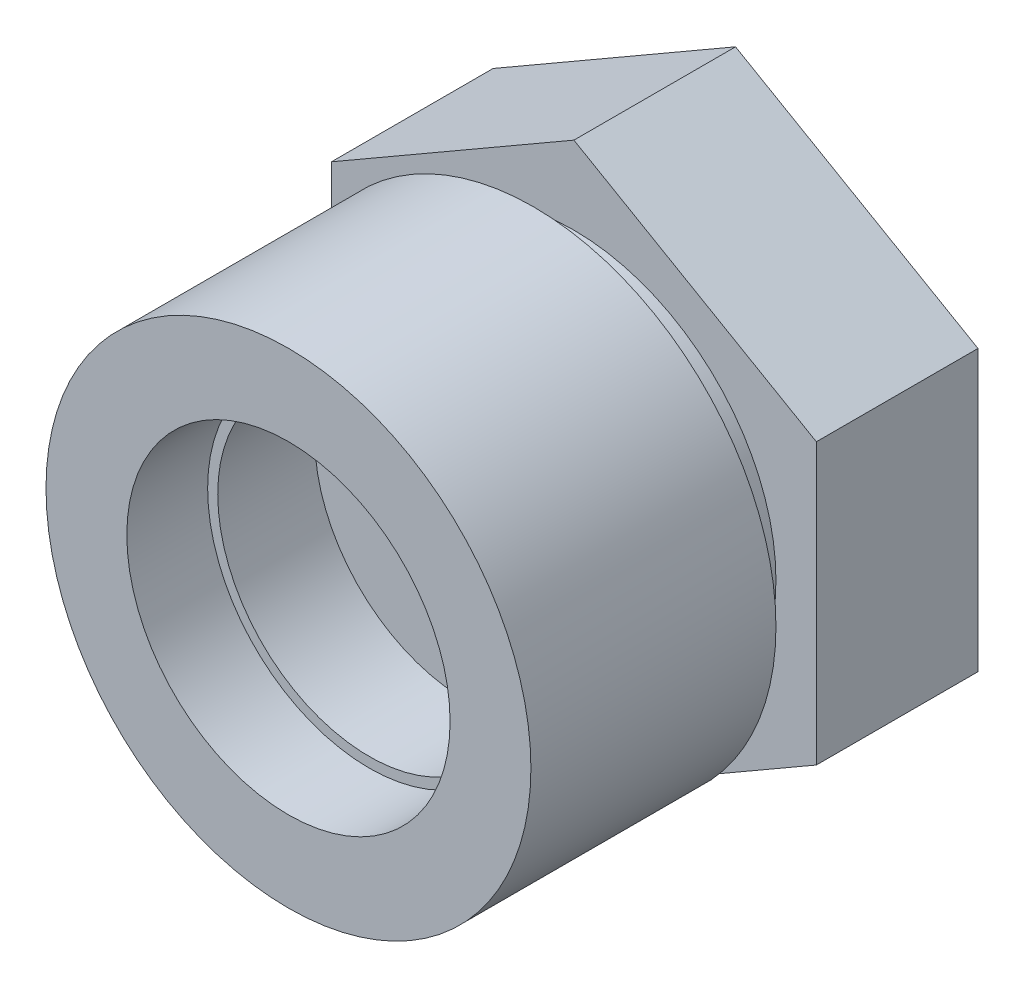
from build123d import *

# Parameters (mm, degrees)
BOSS_EXTRUDE1_DEPTH = 6.35
SKETCH2_R           = 7.9375
BOSS_EXTRUDE3_DEPTH = 1.5875
SKETCH7_R           = 9.525
BOSS_EXTRUDE4_DEPTH = 9.6266
SKETCH10_W          = 2.5527
SKETCH10_H          = 17.5641
SKETCH12_R          = 6.35
CUT_EXTRUDE5_DEPTH  = 3.175
SKETCH13_R          = 5.953125
CUT_EXTRUDE6_DEPTH  = 3.81


with BuildPart() as part:
    # Sketch1 → Boss-Extrude1 (new body)
    with BuildSketch(Plane.XY):
        Polygon((0, -10.998522628), (9.525, -5.499261314), (9.525, 5.499261314), (0, 10.998522628), (-9.525, 5.499261314), (-9.525, -5.499261314), align=None)
    extrude(amount=-BOSS_EXTRUDE1_DEPTH)


with BuildPart() as body_2:
    # Sketch2 → Boss-Extrude3 (new body)
    with BuildSketch(Plane.XY):
        Circle(SKETCH2_R)
    extrude(amount=BOSS_EXTRUDE3_DEPTH)


with BuildPart() as body_3:
    # Sketch7 → Boss-Extrude4 (new body)
    with BuildSketch(Plane.XY.offset(1.5875)):
        Circle(SKETCH7_R)
    extrude(amount=BOSS_EXTRUDE4_DEPTH)


with BuildPart() as f_1_4_20_tapped_hole1_tool:
    # Sketch10 → 1/4-20 Tapped Hole1 (revolve)
    with BuildSketch(Plane(origin=(0, 0, -6.35), x_dir=(0, 1, 0), z_dir=(1, 0, 0))):
        with Locations((1.27635, 8.78205)):
            Rectangle(SKETCH10_W, SKETCH10_H)
    revolve(axis=Axis((0, 0, -12.7), (0, 0, 1)))


with BuildPart() as part_1:
    add(part.part)

    # 1/4-20 Tapped Hole1: cut by f_1_4_20_tapped_hole1_tool
    add(f_1_4_20_tapped_hole1_tool.part, mode=Mode.SUBTRACT)


with BuildPart() as body_2_1:
    add(body_2.part)

    # 1/4-20 Tapped Hole1: cut by f_1_4_20_tapped_hole1_tool
    add(f_1_4_20_tapped_hole1_tool.part, mode=Mode.SUBTRACT)


with BuildPart() as body_3_1:
    add(body_3.part)

    # 1/4-20 Tapped Hole1: cut by f_1_4_20_tapped_hole1_tool
    add(f_1_4_20_tapped_hole1_tool.part, mode=Mode.SUBTRACT)

    # Sketch12 → Cut-Extrude5 (cut)
    with BuildSketch(Plane.XY.offset(11.2141)):
        Circle(SKETCH12_R)
    extrude(amount=-CUT_EXTRUDE5_DEPTH, mode=Mode.SUBTRACT)

    # Sketch13 → Cut-Extrude6 (cut)
    with BuildSketch(Plane.XY.offset(8.0391)):
        Circle(SKETCH13_R)
    extrude(amount=-CUT_EXTRUDE6_DEPTH, mode=Mode.SUBTRACT)


solid = Compound([part_1.part, body_2_1.part, body_3_1.part])
